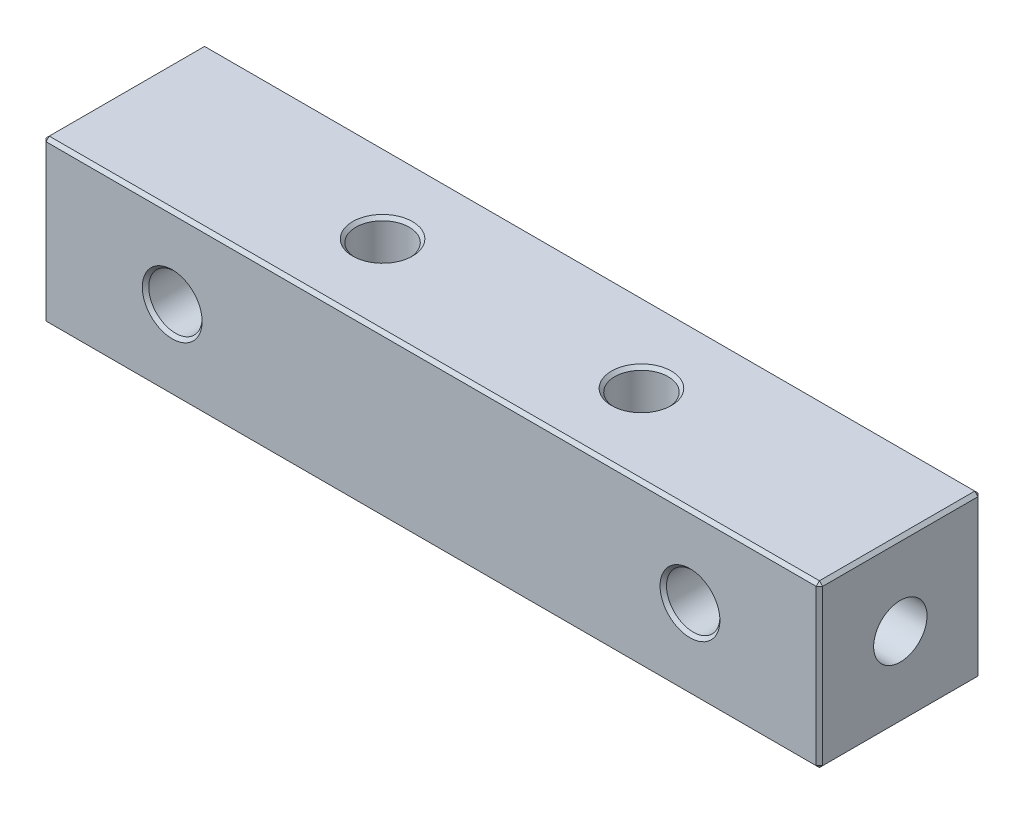
from build123d import *

# Parameters (mm, degrees)
SKETCH_1_W              = 48
SKETCH_1_H              = 10
EXTRUDE_1_DEPTH         = 5
HOLE_WIZARD_M4_1_D      = 3.3
HOLE_WIZARD_M4_2_D      = 3.3
CHAMFER_1_SIZE          = 0.2
HOLE_WIZARD_M4_3_REACH  = 50.518
HOLE_WIZARD_M4_3_BORE_R = 1.65
HOLE_WIZARD_M4_4_REACH  = 50.518
HOLE_WIZARD_M4_4_BORE_R = 1.65


with BuildPart() as part:
    # 草图1 → 凸台-拉伸1 (new, symmetric)
    with BuildSketch(Plane(origin=(0, 0, 0), x_dir=(1, 0, 0), z_dir=(0, 1, 0))):
        Rectangle(SKETCH_1_W, SKETCH_1_H)
    extrude(amount=EXTRUDE_1_DEPTH, both=True)

    # M4 螺纹孔1 (through all)
    with Locations(Plane(origin=(0, 5, 0), x_dir=(1, 0, 0), z_dir=(0, 1, 0))):
        with Locations((-8, 0), (8, 0)):
            Hole(HOLE_WIZARD_M4_1_D / 2)

    # M4 螺纹孔2 (through all)
    with Locations(Plane(origin=(0, 0, -5), x_dir=(-1, 0, 0), z_dir=(0, 0, -1))):
        with Locations((-16, 0), (16, 0)):
            Hole(HOLE_WIZARD_M4_2_D / 2)

    # 倒角1
    chamfer_1_edges = [part.edges().sort_by_distance(p)[0] for p in [
        (-24, 5, 0),
        (9.65, 5, 0),
        (9.65, -5, 0),
        (0, 5, 5),
        (-6.35, 5, 0),
        (-6.35, -5, 0),
        (-17.65, 0, -5),
        (-17.65, 0, 5),
        (14.35, 0, -5),
        (14.35, 0, 5),
        (24, 5, 0),
        (0, -5, 5),
        (-24, -5, 0),
        (0, -5, -5),
        (24, -5, 0),
        (24, 0, 5),
        (-24, 0, 5),
        (-24, 0, -5),
        (24, 0, -5),
        (0, 5, -5),
    ]]
    chamfer(chamfer_1_edges, length=CHAMFER_1_SIZE)

    # M4 螺纹孔3 bore → M4 螺纹孔3 (cut, up to next)
    with BuildSketch(Plane.ZY.offset(24), mode=Mode.PRIVATE) as hole_wizard_m4_3_sk1:
        Circle(HOLE_WIZARD_M4_3_BORE_R)
    hole_wizard_m4_3_tool1 = extrude(hole_wizard_m4_3_sk1.sketch, amount=-HOLE_WIZARD_M4_3_REACH, mode=Mode.PRIVATE) & part.part
    add(hole_wizard_m4_3_tool1.solids().sort_by_distance((-24, 0, 0))[0], mode=Mode.SUBTRACT)

    # M4 螺纹孔4 bore → M4 螺纹孔4 (cut, up to next)
    with BuildSketch(Plane(origin=(24, 0, 0), x_dir=(0, 0, -1), z_dir=(1, 0, 0)), mode=Mode.PRIVATE) as hole_wizard_m4_4_sk1:
        Circle(HOLE_WIZARD_M4_4_BORE_R)
    hole_wizard_m4_4_tool1 = extrude(hole_wizard_m4_4_sk1.sketch, amount=-HOLE_WIZARD_M4_4_REACH, mode=Mode.PRIVATE) & part.part
    add(hole_wizard_m4_4_tool1.solids().sort_by_distance((24, 0, 0))[0], mode=Mode.SUBTRACT)


solid = part.part
